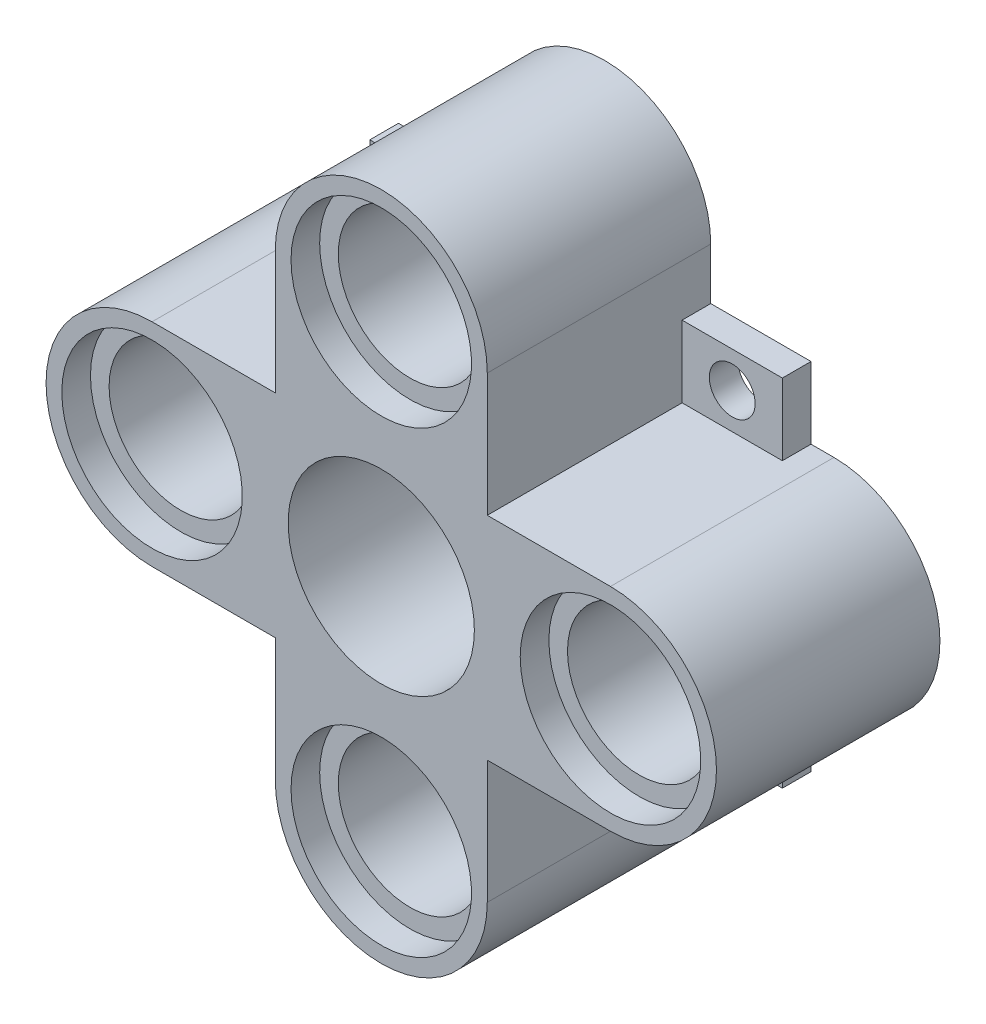
from build123d import *

# Parameters (mm, degrees)
SKETCH_2_W          = 23.4
SKETCH_2_H          = 7.4
SKETCH_2_W_2        = 7.4
SKETCH_2_H_2        = 23.4
EXTRUDE_1_DEPTH     = 7.8
SKETCH_3_W          = 14.4
SKETCH_3_H          = 12.4
EXTRUDE_2_DEPTH     = 1
SKETCH_2_6_R        = 2.5
SKETCH_2_6_R_2      = 3.25
CUT_EXTRUDE_3_DEPTH = 19.292621463
SKETCH_2_3_R        = 3.15
CUT_EXTRUDE_1_DEPTH = 1
CUT_EXTRUDE_START   = 6.8
SKETCH_2_5_R        = 3.15
CUT_EXTRUDE_2_DEPTH = 1
SKETCH_4_R          = 0.8
CUT_EXTRUDE_4_DEPTH = 18.889102828


with BuildPart() as part:
    # 草图2 → 凸台-拉伸1 (new body)
    with BuildSketch(Plane.XY):
        Rectangle(SKETCH_2_W, SKETCH_2_H)
        Rectangle(SKETCH_2_W_2, SKETCH_2_H_2)
    extrude(amount=EXTRUDE_1_DEPTH)

    # 草图3 → 凸台-拉伸2 (add)
    with BuildSketch(Plane(origin=(0, 0, 0), x_dir=(-1, 0, 0), z_dir=(0, 0, -1))):
        Rectangle(SKETCH_3_W, SKETCH_3_H)
    extrude(amount=-EXTRUDE_2_DEPTH)

    # 草图2<6> → 切除-拉伸3 (cut, through all)
    with BuildSketch(Plane.XY):
        with BuildLine():
            Line((-3.7, 11.7), (-3.7, 8))
            ThreePointArc((-3.7, 8), (-2.61629509, 10.61629509), (0, 11.7))
            Line((0, 11.7), (-3.7, 11.7))
        make_face()
        with BuildLine():
            ThreePointArc((0, 11.7), (2.61629509, 10.61629509), (3.7, 8))
            Line((3.7, 8), (3.7, 11.7))
            Line((3.7, 11.7), (0, 11.7))
        make_face()
        with BuildLine():
            Line((11.7, 3.7), (8.000000006, 3.7))
            ThreePointArc((8.000000006, 3.7), (10.616295093, 2.616295088), (11.7, 0))
            Line((11.7, 0), (11.7, 3.7))
        make_face()
        with BuildLine():
            ThreePointArc((11.7, 0), (10.616295085, -2.616295096), (7.999999984, -3.7))
            Line((7.999999984, -3.7), (11.7, -3.7))
            Line((11.7, -3.7), (11.7, 0))
        make_face()
        with BuildLine():
            Line((3.7, -11.7), (3.7, -8))
            ThreePointArc((3.7, -8), (2.61629509, -10.61629509), (0, -11.7))
            Line((0, -11.7), (3.7, -11.7))
        make_face()
        with BuildLine():
            ThreePointArc((0, -11.7), (-2.616295094, -10.616295087), (-3.7, -7.99999999))
            Line((-3.7, -7.99999999), (-3.7, -11.7))
            Line((-3.7, -11.7), (0, -11.7))
        make_face()
        with BuildLine():
            Line((-11.7, -1.1e-08), (-11.7, -3.7))
            Line((-11.7, -3.7), (-8.000000004, -3.7))
            ThreePointArc((-8.000000004, -3.7), (-10.616295088, -2.616295093), (-11.7, -1.1e-08))
        make_face()
        with BuildLine():
            Line((-11.7, 3.7), (-11.7, -1.1e-08))
            ThreePointArc((-11.7, -1.1e-08), (-10.616295094, 2.616295086), (-8, 3.7))
            Line((-8, 3.7), (-11.7, 3.7))
        make_face()
        with Locations((0, 8)):
            Circle(SKETCH_2_6_R)
        with Locations((-8, 0)):
            Circle(SKETCH_2_6_R)
        Circle(SKETCH_2_6_R_2)
        with Locations((8, 0)):
            Circle(SKETCH_2_6_R)
        with Locations((0, -8)):
            Circle(SKETCH_2_6_R)
    extrude(amount=CUT_EXTRUDE_3_DEPTH, mode=Mode.SUBTRACT)

    # 草图2<3> → 切除-拉伸1 (cut)
    with BuildSketch(Plane.XY):
        with Locations((8, 0)):
            Circle(SKETCH_2_3_R)
        with Locations((-8, 0)):
            Circle(SKETCH_2_3_R)
        with Locations((0, 8)):
            Circle(SKETCH_2_3_R)
        with Locations((0, -8)):
            Circle(SKETCH_2_3_R)
    extrude(amount=CUT_EXTRUDE_1_DEPTH, mode=Mode.SUBTRACT)

    # 草图2<5> → 切除-拉伸2 (cut)
    with BuildSketch(Plane.XY.offset(CUT_EXTRUDE_START)):
        with Locations((8, 0)):
            Circle(SKETCH_2_5_R)
        with Locations((-8, 0)):
            Circle(SKETCH_2_5_R)
        with Locations((0, 8)):
            Circle(SKETCH_2_5_R)
        with Locations((0, -8)):
            Circle(SKETCH_2_5_R)
    extrude(amount=CUT_EXTRUDE_2_DEPTH, mode=Mode.SUBTRACT)

    # 草图4 → 切除-拉伸4 (cut, through all)
    with BuildSketch(Plane.XY.offset(1)):
        with Locations((-5.45, 4.95)):
            Circle(SKETCH_4_R)
        with Locations((5.45, 4.95)):
            Circle(SKETCH_4_R)
        with Locations((-5.45, -4.95)):
            Circle(SKETCH_4_R)
        with Locations((5.45, -4.95)):
            Circle(SKETCH_4_R)
    extrude(amount=-CUT_EXTRUDE_4_DEPTH, mode=Mode.SUBTRACT)


solid = part.part
